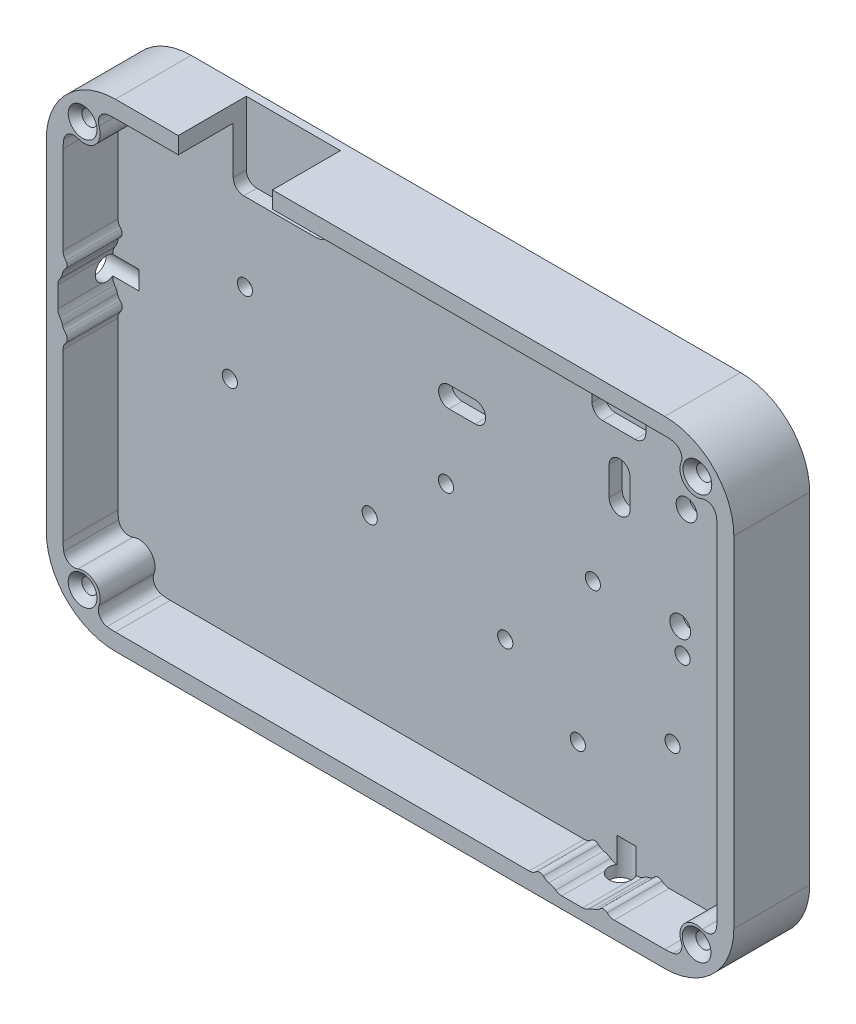
from build123d import *

# Parameters (mm, degrees)
EXTRUDE_1_DEPTH               = 4
EXTRUDE_2_DEPTH               = 10.5
HOLE_WIZARD_M2_51_D           = 2.9
HOLE_WIZARD_M2_51_DEPTH       = 8
HOLE_WIZARD_M2_51_CSINK_D     = 5.5
HOLE_WIZARD_M2_51_CSINK_ANGLE = 90
HOLE_WIZARD_M2_51_TIP         = 0.871247898
SKETCH_11_R                   = 2
CUT_EXTRUDE_1_DEPTH           = 2.5
CUT_EXTRUDE_3_DEPTH           = 5
CUT_EXTRUDE_3_DEPTH_BACK      = 5
SKETCH_13_R                   = 2.15
CUT_EXTRUDE_4_DEPTH           = 7
CUT_EXTRUDE_4_DEPTH_BACK      = 7
SKETCH_18_R                   = 2.15
HOLE_WIZARD_M2_55_D           = 2.9
HOLE_WIZARD_M2_55_DEPTH       = 2.7
HOLE_WIZARD_M2_55_TIP         = 0.871247898
HOLE_WIZARD_M2_56_D           = 2.9
HOLE_WIZARD_M2_56_DEPTH       = 2.7
HOLE_WIZARD_M2_56_TIP         = 0.871247898
HOLE_WIZARD_M2_57_D           = 2.9
HOLE_WIZARD_M2_57_DEPTH       = 2
HOLE_WIZARD_M2_57_TIP         = 0.871247898


with BuildPart() as part:
    # BSRED → Бобышка-Вытянуть1 (new body)
    with BuildSketch(Plane.XY):
        with BuildLine():
            Line((0, 78.2), (105, 78.2))
            ThreePointArc((105, 78.2), (114.333809512, 74.333809512), (118.2, 65))
            Line((118.2, 65), (118.2, 0))
            ThreePointArc((118.2, 0), (114.333809512, -9.333809512), (105, -13.2))
            Line((105, -13.2), (0, -13.2))
            ThreePointArc((0, -13.2), (-9.333809512, -9.333809512), (-13.2, 0))
            Line((-13.2, 0), (-13.2, 65))
            ThreePointArc((-13.2, 65), (-9.333809512, 74.333809512), (0, 78.2))
        make_face()
    extrude(amount=EXTRUDE_1_DEPTH)

    # Эскиз7 → Бобышка-Вытянуть2 (add)
    with BuildSketch(Plane.XY.offset(4)):
        with BuildLine():
            Line((-10, 48.139609585), (-10, 65))
            ThreePointArc((-10, 65), (-9.968409567, 65.79423593), (-9.873837857, 66.583453809))
            ThreePointArc((-9.873837857, 66.583453809), (-8.884334774, 68.007238238), (-7.15433684, 68.122934401))
            ThreePointArc((-7.15433684, 68.122934401), (-3.807968978, 68.807968978), (-3.122934401, 72.15433684))
            ThreePointArc((-3.122934401, 72.15433684), (-3.007238238, 73.884334774), (-1.583453809, 74.873837857))
            ThreePointArc((-1.583453809, 74.873837857), (-0.79423593, 74.968409567), (0, 75))
            Line((0, 75), (12.02500062, 75))
            Line((12.02500062, 75), (12.02500062, 78.2))
            Line((12.02500062, 78.2), (0, 78.2))
            ThreePointArc((0, 78.2), (-9.333809512, 74.333809512), (-13.2, 65))
            Line((-13.2, 65), (-13.2, 0))
            ThreePointArc((-13.2, 0), (-9.333809512, -9.333809512), (0, -13.2))
            Line((0, -13.2), (105, -13.2))
            ThreePointArc((105, -13.2), (114.333809512, -9.333809512), (118.2, 0))
            Line((118.2, 0), (118.2, 65))
            ThreePointArc((118.2, 65), (114.333809512, 74.333809512), (105, 78.2))
            Line((105, 78.2), (30.0249991, 78.2))
            Line((30.0249991, 78.2), (30.0249991, 75))
            Line((30.0249991, 75), (105, 75))
            ThreePointArc((105, 75), (105.79423593, 74.968409567), (106.583453809, 74.873837857))
            ThreePointArc((106.583453809, 74.873837857), (108.007238238, 73.884334774), (108.122934401, 72.15433684))
            ThreePointArc((108.122934401, 72.15433684), (108.807968978, 68.807968978), (112.15433684, 68.122934401))
            ThreePointArc((112.15433684, 68.122934401), (113.884334774, 68.007238238), (114.873837857, 66.583453809))
            ThreePointArc((114.873837857, 66.583453809), (114.968409567, 65.79423593), (115, 65))
            Line((115, 65), (115, 0))
            ThreePointArc((115, 0), (114.968409567, -0.79423593), (114.873837857, -1.583453809))
            ThreePointArc((114.873837857, -1.583453809), (113.884334774, -3.007238238), (112.15433684, -3.122934401))
            ThreePointArc((112.15433684, -3.122934401), (108.807968978, -3.807968978), (108.122934401, -7.15433684))
            ThreePointArc((108.122934401, -7.15433684), (108.007238238, -8.884334774), (106.583453809, -9.873837857))
            ThreePointArc((106.583453809, -9.873837857), (105.79423593, -9.968409567), (105, -10))
            Line((105, -10), (95.339606643, -10))
            ThreePointArc((95.339606643, -10), (94.609309896, -9.861898671), (93.9798681, -9.466666661))
            ThreePointArc((93.9798681, -9.466666661), (93.262036306, -9.200720824), (92.566450912, -9.520362236))
            ThreePointArc((92.566450912, -9.520362236), (92.118251575, -9.882089339), (91.585552825, -10.101089761))
            ThreePointArc((91.585552825, -10.101089761), (90.986780865, -10.311996834), (90.437405207, -10.630110084))
            ThreePointArc((90.437405207, -10.630110084), (89.886823898, -10.905284778), (89.27863814, -11))
            Line((89.27863814, -11), (85.321469946, -11))
            ThreePointArc((85.321469946, -11), (84.713203712, -10.905259087), (84.162565175, -10.630012187))
            ThreePointArc((84.162565175, -10.630012187), (83.537963843, -10.278266515), (82.853686145, -10.064687787))
            ThreePointArc((82.853686145, -10.064687787), (82.291927185, -9.86135531), (81.815287638, -9.501172069))
            ThreePointArc((81.815287638, -9.501172069), (81.124722495, -9.200305701), (80.420128552, -9.466666667))
            ThreePointArc((80.420128552, -9.466666667), (79.790686758, -9.861898673), (79.060390015, -10))
            Line((79.060390015, -10), (0, -10))
            ThreePointArc((0, -10), (-0.79423593, -9.968409567), (-1.583453809, -9.873837857))
            ThreePointArc((-1.583453809, -9.873837857), (-3.007238238, -8.884334774), (-3.122934401, -7.15433684))
            ThreePointArc((-3.122934401, -7.15433684), (-3.807968978, -3.807968978), (-7.15433684, -3.122934401))
            ThreePointArc((-7.15433684, -3.122934401), (-8.884334774, -3.007238238), (-9.873837857, -1.583453809))
            ThreePointArc((-9.873837857, -1.583453809), (-9.968409567, -0.79423593), (-10, 0))
            Line((-10, 0), (-10, 31.745078842))
            ThreePointArc((-10, 31.745078842), (-9.874806846, 32.441569538), (-9.514900711, 33.050864367))
            ThreePointArc((-9.514900711, 33.050864367), (-9.200397685, 33.949731339), (-9.582671347, 34.821935922))
            ThreePointArc((-9.582671347, 34.821935922), (-9.907307533, 35.245354744), (-10.108444363, 35.739537027))
            ThreePointArc((-10.108444363, 35.739537027), (-10.318155945, 36.325015422), (-10.630590945, 36.86274051))
            ThreePointArc((-10.630590945, 36.86274051), (-10.905410965, 37.413040516), (-11, 38.020830821))
            Line((-11, 38.020830821), (-11, 41.979179159))
            ThreePointArc((-11, 41.979179159), (-10.905413336, 42.586962031), (-10.630599981, 43.137256749))
            ThreePointArc((-10.630599981, 43.137256749), (-10.295788223, 43.724143081), (-10.083107733, 44.365470993))
            ThreePointArc((-10.083107733, 44.365470993), (-9.87177182, 44.913007628), (-9.510598065, 45.375622755))
            ThreePointArc((-9.510598065, 45.375622755), (-9.200489005, 46.068732441), (-9.466666667, 46.779871048))
            ThreePointArc((-9.466666667, 46.779871048), (-9.861898673, 47.409312842), (-10, 48.139609585))
        make_face()
    extrude(amount=EXTRUDE_2_DEPTH)

    # Отверстие с зазором M2.51
    with Locations(Plane.XY.offset(14.5)):
        with Locations((-6.262652301, 71.345749201), (-6.262652301, -6.147394828), (111.095522586, -6.147394828), (111.233130089, 71.345749201)):
            CounterSinkHole(HOLE_WIZARD_M2_51_D / 2, HOLE_WIZARD_M2_51_CSINK_D / 2, depth=HOLE_WIZARD_M2_51_DEPTH, counter_sink_angle=HOLE_WIZARD_M2_51_CSINK_ANGLE)
            with Locations((0, 0, -(HOLE_WIZARD_M2_51_DEPTH + HOLE_WIZARD_M2_51_TIP / 2))):  # 118° drill point
                Cone(0, HOLE_WIZARD_M2_51_D / 2, HOLE_WIZARD_M2_51_TIP, mode=Mode.SUBTRACT)

    # Эскиз11 → Вырез-Вытянуть1 (cut)
    with BuildSketch(Plane.XY.offset(4)):
        with Locations((97.4500083, 34.42326618)):
            Circle(SKETCH_11_R)
        with Locations((98.67500966, 54.38576372)):
            Circle(SKETCH_11_R)
        with BuildLine():
            Line((12.02500062, 78.2), (30.0249991, 78.2))
            Line((30.0249991, 78.2), (30.0249991, 65.97500086))
            ThreePointArc((30.0249991, 65.97500086), (29.439212662, 64.560787298), (28.0249991, 63.97500086))
            Line((28.0249991, 63.97500086), (14.02500062, 63.97500086))
            ThreePointArc((14.02500062, 63.97500086), (12.610787058, 64.560787298), (12.02500062, 65.97500086))
            Line((12.02500062, 65.97500086), (12.02500062, 78.2))
        make_face()
        with BuildLine():
            Line((53.27499894, 52.32499968), (58.27499894, 52.32499968))
            ThreePointArc((58.27499894, 52.32499968), (60.27499894, 50.32499968), (58.27499894, 48.32499968))
            Line((58.27499894, 48.32499968), (53.27499894, 48.32499968))
            ThreePointArc((53.27499894, 48.32499968), (51.27499894, 50.32499968), (53.27499894, 52.32499968))
        make_face()
        with BuildLine():
            Line((83.86500988, 48.92326258), (83.86500988, 54.37326184))
            ThreePointArc((83.86500988, 54.37326184), (85.86500988, 56.37326184), (87.86500988, 54.37326184))
            Line((87.86500988, 54.37326184), (87.86500988, 48.92326258))
            ThreePointArc((87.86500988, 48.92326258), (85.86500988, 46.92326258), (83.86500988, 48.92326258))
        make_face()
        with BuildLine():
            Line((82.594794537, 69.933338573), (88.877730302, 69.933338573))
            ThreePointArc((88.877730302, 69.933338573), (90.291943864, 69.347552135), (90.877730302, 67.933338573))
            Line((90.877730302, 67.933338573), (90.877730302, 63.081646544))
            ThreePointArc((90.877730302, 63.081646544), (90.291943864, 61.667432981), (88.877730302, 61.081646544))
            Line((88.877730302, 61.081646544), (82.594794537, 61.081646544))
            ThreePointArc((82.594794537, 61.081646544), (81.180580974, 61.667432981), (80.594794537, 63.081646544))
            Line((80.594794537, 63.081646544), (80.594794537, 67.933338573))
            ThreePointArc((80.594794537, 67.933338573), (81.180580974, 69.347552135), (82.594794537, 69.933338573))
        make_face()
    extrude(amount=-CUT_EXTRUDE_1_DEPTH, mode=Mode.SUBTRACT)

    # Эскиз13 → Вырез-Вытянуть3 (cut, two sides: drawn at the far end of the back side and taken through both)
    with BuildSketch(Plane(origin=(-11, 0, 0), x_dir=(0, 0, -1), z_dir=(1, 0, 0)).offset(-CUT_EXTRUDE_3_DEPTH_BACK)):
        with Locations((-5.1983212, 39.999938005)):
            Circle(SKETCH_13_R)
    extrude(amount=CUT_EXTRUDE_3_DEPTH + CUT_EXTRUDE_3_DEPTH_BACK, mode=Mode.SUBTRACT)

    # Эскиз18 → Вырез-Вытянуть4 (cut, two sides: drawn at the far end of the back side and taken through both)
    with BuildSketch(Plane(origin=(0, -13.2, 0), x_dir=(1, 0, 0), z_dir=(0, 1, 0)).offset(-CUT_EXTRUDE_4_DEPTH_BACK)):
        with Locations((87.200058443, -5.194213169)):
            Circle(SKETCH_18_R)
    extrude(amount=CUT_EXTRUDE_4_DEPTH + CUT_EXTRUDE_4_DEPTH_BACK, mode=Mode.SUBTRACT)

    # Отверстие с зазором M2.55
    with Locations(Plane.ZY.offset(13.2)):
        with Locations((5.178477083, 46.123636897), (5.178477083, 33.884164488)):
            Hole(HOLE_WIZARD_M2_55_D / 2, depth=HOLE_WIZARD_M2_55_DEPTH)
            with Locations((0, 0, -(HOLE_WIZARD_M2_55_DEPTH + HOLE_WIZARD_M2_55_TIP / 2))):  # 118° drill point
                Cone(0, HOLE_WIZARD_M2_55_D / 2, HOLE_WIZARD_M2_55_TIP, mode=Mode.SUBTRACT)

    # Отверстие с зазором M2.56
    with Locations(Plane(origin=(0, -13.2, 0), x_dir=(-1, 0, 0), z_dir=(0, -1, 0))):
        with Locations((-93.321816227, -5.179641534), (-81.069511387, -5.179641534)):
            Hole(HOLE_WIZARD_M2_56_D / 2, depth=HOLE_WIZARD_M2_56_DEPTH)
            with Locations((0, 0, -(HOLE_WIZARD_M2_56_DEPTH + HOLE_WIZARD_M2_56_TIP / 2))):  # 118° drill point
                Cone(0, HOLE_WIZARD_M2_56_D / 2, HOLE_WIZARD_M2_56_TIP, mode=Mode.SUBTRACT)

    # Отверстие с зазором M2.57
    with Locations(Plane.XY.offset(4)):
        with Locations((11.373409982, 32.33213016), (14.25267406, 49.01681332), (38.107899385, 23.118292504), (52.686827717, 35.651217854), (64.015398599, 15.535966464), (77.889736869, 5.523917704), (80.757169217, 33.565495408), (97.899998464, 29.804748608), (95.982487925, 14.259810197)):
            Hole(HOLE_WIZARD_M2_57_D / 2, depth=HOLE_WIZARD_M2_57_DEPTH)
            with Locations((0, 0, -(HOLE_WIZARD_M2_57_DEPTH + HOLE_WIZARD_M2_57_TIP / 2))):  # 118° drill point
                Cone(0, HOLE_WIZARD_M2_57_D / 2, HOLE_WIZARD_M2_57_TIP, mode=Mode.SUBTRACT)


solid = part.part
